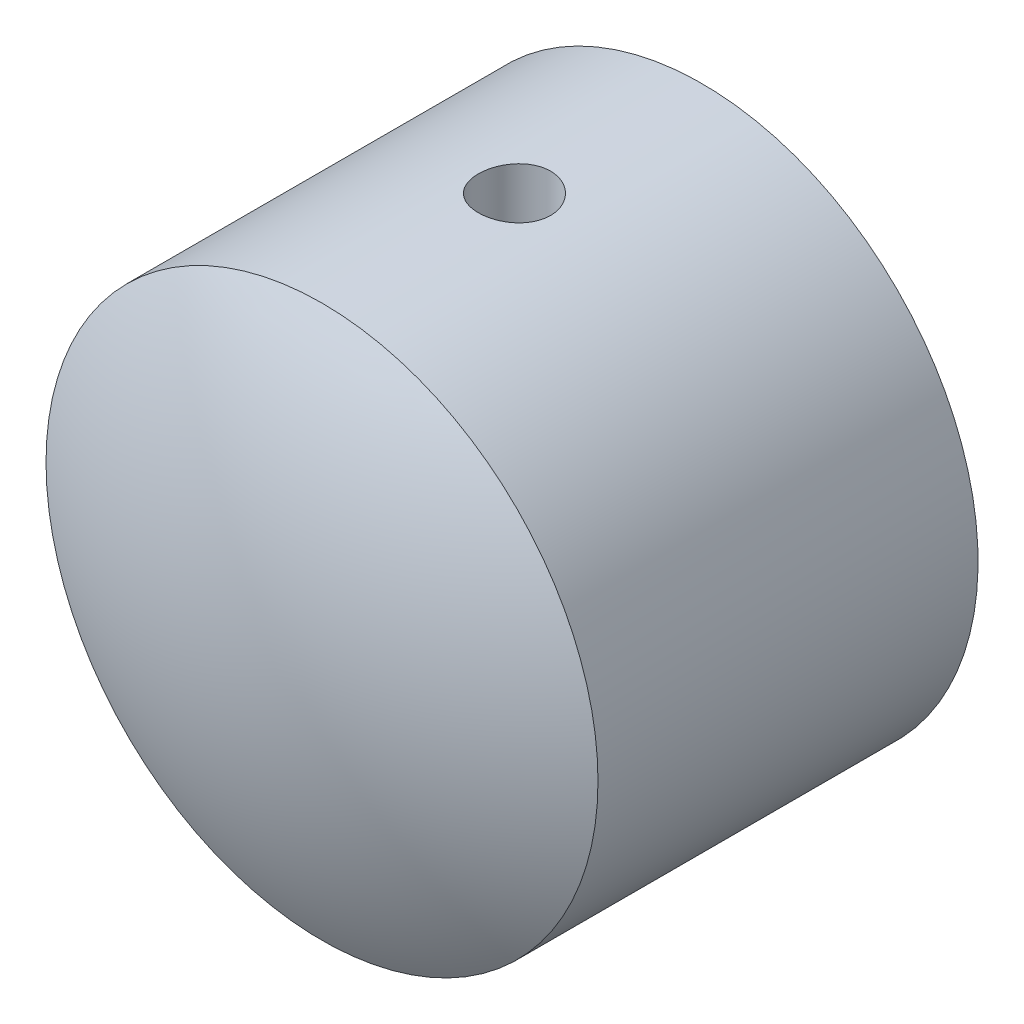
from build123d import *

# Parameters (mm, degrees)
BOSS_EXTRUDE1_DEPTH      = 47.625
BOSS_EXTRUDE1_DEPTH_BACK = 2.54
SKETCH1_R                = 36.426767544
SKETCH4_R                = 4.7625
CUT_EXTRUDE1_DEPTH       = 139.904833197


with BuildPart() as part:
    # Sketch1 → Boss-Extrude1 (new, two sides: drawn at the far end of the back side and taken through both)
    with BuildSketch(Plane.XY.offset(-BOSS_EXTRUDE1_DEPTH_BACK)):
        with Locations((67.114492883, 307.327144707)):
            Circle(SKETCH1_R)
    extrude(amount=BOSS_EXTRUDE1_DEPTH + BOSS_EXTRUDE1_DEPTH_BACK)

    # Sketch3 → Revolve1 (revolve)
    with BuildSketch(Plane(origin=(67.114492883, 0, 0), x_dir=(0, 0, -1), z_dir=(1, 0, 0)), mode=Mode.PRIVATE) as revolve1_sk:
        with BuildLine():
            Line((-47.625, 307.327144707), (-57.15, 307.327144707))
            ThreePointArc((-57.15, 307.327144707), (-54.72938109, 326.152891828), (-47.625, 343.75391225))
            Line((-47.625, 343.75391225), (-47.625, 307.327144707))
        make_face()
        with BuildLine():
            Line((2.54, 307.327144707), (12.065, 307.327144707))
            ThreePointArc((12.065, 307.327144707), (9.64438109, 326.152891828), (2.54, 343.75391225))
            Line((2.54, 343.75391225), (2.54, 307.327144707))
        make_face()
    revolve(revolve1_sk.sketch.rotate(Axis((67.114492883, 307.327144707, 47.625), (0, 0, 1)), 90), axis=Axis((67.114492883, 307.327144707, 47.625), (0, 0, 1)))

    # Sketch4 → Cut-Extrude1 (cut, through all)
    with BuildSketch(Plane(origin=(0, 343.75391225, 0), x_dir=(1, 0, 0), z_dir=(0, 1, 0))):
        with Locations(Location((67.114492883, -22.225, 0), (0, 0, 270))):
            Circle(SKETCH4_R)
    extrude(amount=-CUT_EXTRUDE1_DEPTH, mode=Mode.SUBTRACT)


solid = part.part
